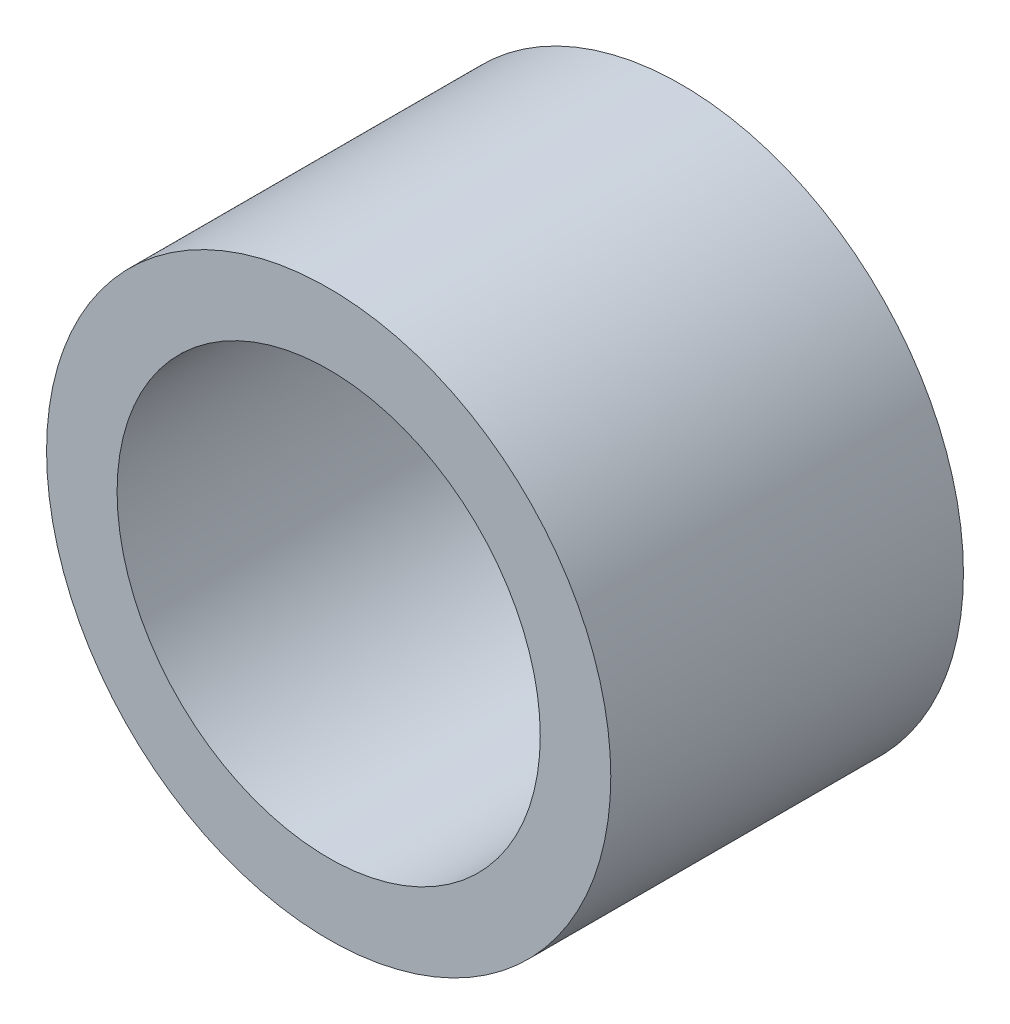
from build123d import *

# Parameters (mm, degrees)
SKETCH1_R           = 2
BOSS_EXTRUDE1_DEPTH = 2.5
SKETCH2_R           = 1.5
CUT_EXTRUDE1_DEPTH  = 2.5


with BuildPart() as part:
    # Sketch1 → Boss-Extrude1 (new body)
    with BuildSketch(Plane.XY):
        Circle(SKETCH1_R)
    extrude(amount=BOSS_EXTRUDE1_DEPTH)

    # Sketch2 → Cut-Extrude1 (cut)
    with BuildSketch(Plane.XY):
        Circle(SKETCH2_R)
    extrude(amount=CUT_EXTRUDE1_DEPTH, mode=Mode.SUBTRACT)


solid = part.part
